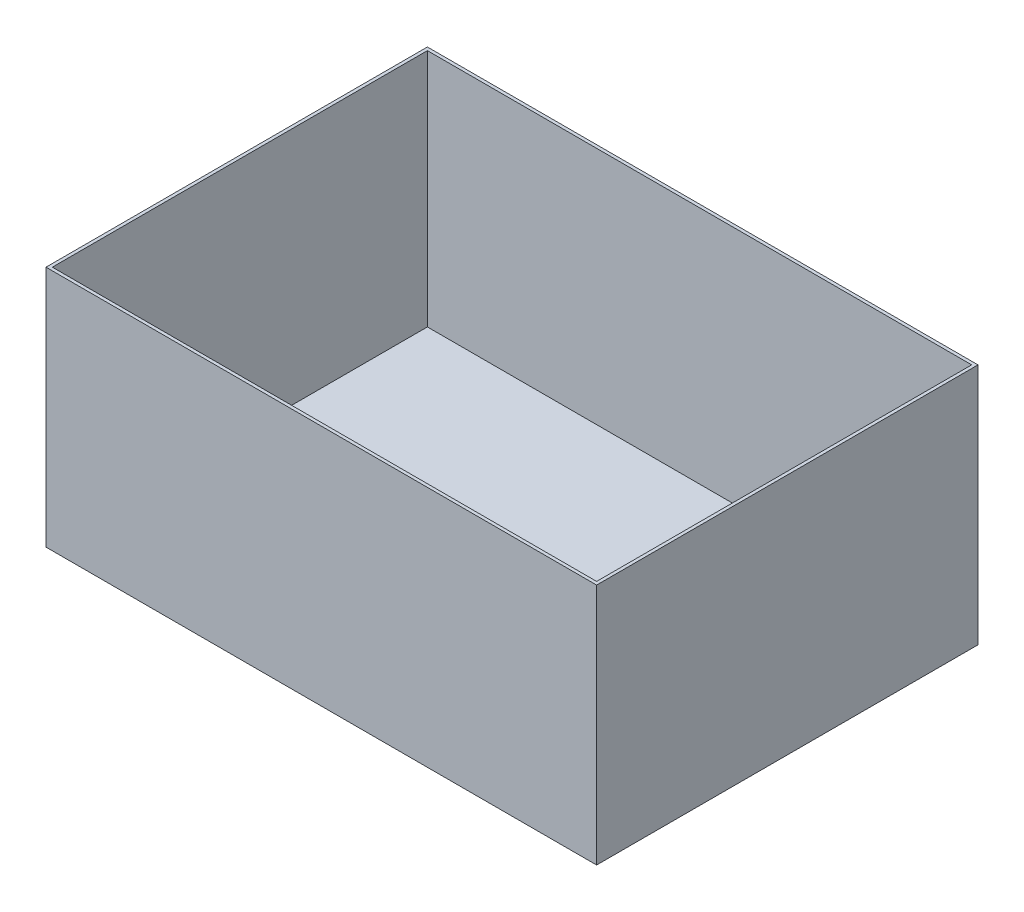
from build123d import *

# Parameters (mm, degrees)
SKETCH1_W           = 553.72
SKETCH1_H           = 383.54
BOSS_EXTRUDE1_DEPTH = 243.84
SHELL1_T            = -3.175


with BuildPart() as part:
    # Sketch1 → Boss-Extrude1 (new body)
    with BuildSketch(Plane(origin=(0, 0, 0), x_dir=(1, 0, 0), z_dir=(0, 1, 0))):
        Rectangle(SKETCH1_W, SKETCH1_H)
    extrude(amount=BOSS_EXTRUDE1_DEPTH)

    # Shell1
    shell1_openings = [part.faces().sort_by_distance(p)[0] for p in [
        (0, 243.84, 0),
    ]]
    offset(amount=SHELL1_T, openings=shell1_openings, kind=Kind.INTERSECTION)


solid = part.part
